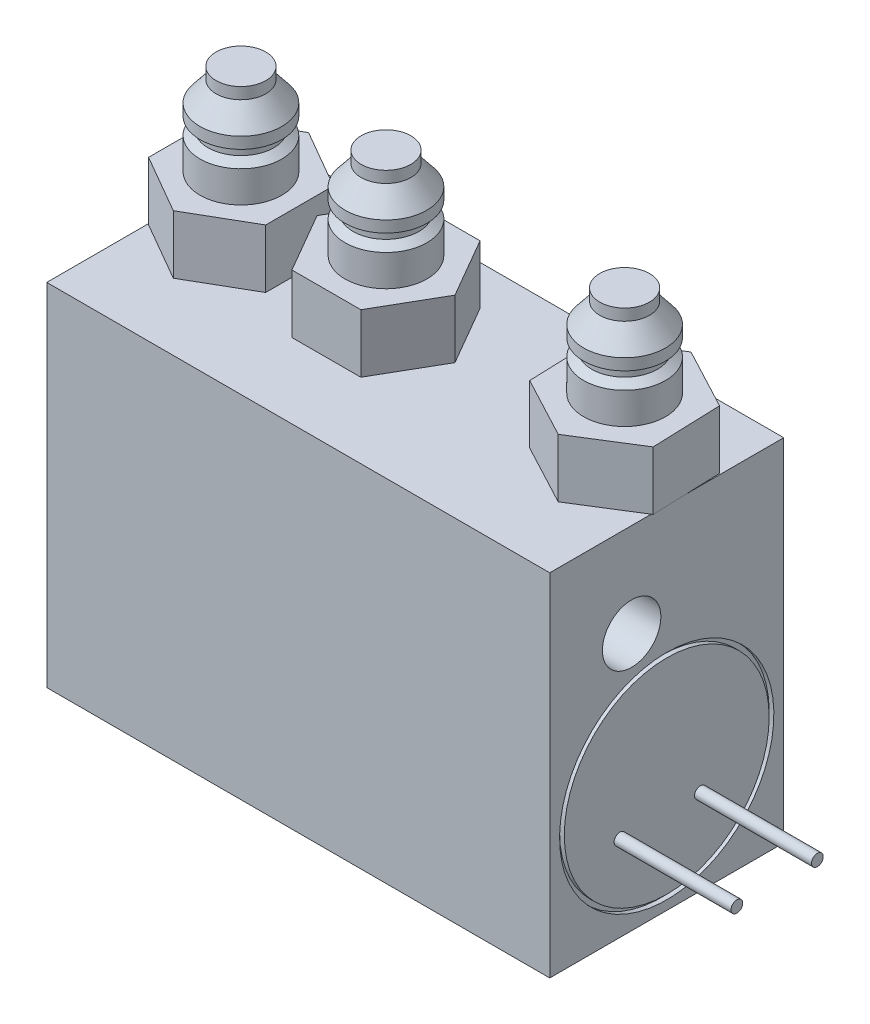
from build123d import *

# Parameters (mm, degrees)
ESQUISSE1_W               = 21.5
ESQUISSE1_H               = 15
EXTRUSION1_DEPTH          = 10
EXTRUSION2_DEPTH          = 2.5
ESQUISSE4_R               = 1.75
EXTRUSION3_DEPTH          = 3.9
ESQUISSE7_R               = 0.25
EXTRUSION4_DEPTH          = 5
ESQUISSE8_R               = 4.580355977
ESQUISSE8_R_2             = 4.37854461
ENL_V_MAT_EXTRU_3_DEPTH   = 0.2
TROU_TARAUD_M3X0_52_D     = 2.5
TROU_TARAUD_M3X0_52_DEPTH = 5.5
TROU_TARAUD_M3X0_52_TIP   = 0.751075774


with BuildPart() as part:
    # Esquisse1 → Extrusion1 (new body)
    with BuildSketch(Plane.XY):
        with Locations((-2.605785234, -7.251083667)):
            Rectangle(ESQUISSE1_W, ESQUISSE1_H)
    extrude(amount=EXTRUSION1_DEPTH)

    # Esquisse2 → Extrusion2 (add)
    with BuildSketch(Plane(origin=(0, 0.248916333, 0), x_dir=(-1, 0, 0), z_dir=(0, 1, 0))):
        Polygon((13.309313152, 5.695412518), (10.805785234, 7.140825036), (8.302257315, 5.695412518), (8.302257315, 2.804587482), (10.805785234, 1.359174964), (13.309313152, 2.804587482), align=None)
        Polygon((6.076207844, 6.801050244), (3.131722221, 6.798948457), (1.661299611, 4.247898212), (3.135362624, 1.698949756), (6.079848247, 1.701051543), (7.550270856, 4.252101788), align=None)
        Polygon((-3.097880639, 5.811510782), (-5.698355708, 7.192644162), (-8.194689836, 5.63113338), (-8.090548894, 2.688489218), (-5.490073824, 1.307355838), (-2.993739697, 2.86886662), align=None)
    extrude(amount=EXTRUSION2_DEPTH)

    # Esquisse4 → Extrusion3 (add)
    with BuildSketch(Plane(origin=(0, 2.748916333, 0), x_dir=(-1, 0, 0), z_dir=(0, 1, 0))):
        with Locations((10.805785234, 4.25)):
            Circle(ESQUISSE4_R)
        with Locations((4.605785234, 4.25)):
            Circle(ESQUISSE4_R)
        with Locations((-5.594214766, 4.25)):
            Circle(ESQUISSE4_R)
    extrude(amount=EXTRUSION3_DEPTH)

    # Esquisse7 → Extrusion4 (add)
    with BuildSketch(Plane(origin=(8.144214766, 0, 0), x_dir=(0, 0, -1), z_dir=(1, 0, 0))):
        with Locations((-3.56, -11.101083667)):
            Circle(ESQUISSE7_R)
        with Locations((-7, -11.101083667)):
            Circle(ESQUISSE7_R)
    extrude(amount=EXTRUSION4_DEPTH)

    # Esquisse8 → Enlèv. mat.-Extru.3 (cut)
    with BuildSketch(Plane(origin=(8.144214766, 0, 0), x_dir=(0, 0, -1), z_dir=(1, 0, 0))):
        with Locations((-5, -9.777233514)):
            Circle(ESQUISSE8_R)
        with Locations((-5, -9.777233514)):
            Circle(ESQUISSE8_R_2, mode=Mode.SUBTRACT)
    extrude(amount=-ENL_V_MAT_EXTRU_3_DEPTH, mode=Mode.SUBTRACT)

    # Trou taraudé M3x0.52
    with Locations(Plane(origin=(8.144214766, -3.751083667, 6.5), x_dir=(0, 1, 0), z_dir=(1, 0, 0))):
        with Locations((0, 0)):
            Hole(TROU_TARAUD_M3X0_52_D / 2, depth=TROU_TARAUD_M3X0_52_DEPTH)
            with Locations((0, 0, -(TROU_TARAUD_M3X0_52_DEPTH + TROU_TARAUD_M3X0_52_TIP / 2))):  # 118° drill point
                Cone(0, TROU_TARAUD_M3X0_52_D / 2, TROU_TARAUD_M3X0_52_TIP, mode=Mode.SUBTRACT)

    # Esquisse13 → Enlèvement de matière-Révolution1 (revolve, cut)
    with BuildSketch(Plane.XY.offset(4.25)):
        Polygon((-9.744077061, 6.648916333), (-9.744077061, 6.159304946), (-9.055785234, 5.295659421), (-9.055785234, 4.809098562), (-9.399931147, 4.809098562), (-9.399931147, 4.334701724), (-9.055785234, 4.091421295), (-9.055785234, 2.748916333), (-8.612823064, 2.748916333), (-8.612823064, 6.648916333), align=None)
    revolve(axis=Axis((-10.805785234, 6.648916333, 4.25), (0, -1, 0)), mode=Mode.SUBTRACT)

    # Esquisse14 → Enlèvement de matière-Révolution2 (revolve, cut)
    with BuildSketch(Plane.XY.offset(4.25)):
        Polygon((-3.544077061, 6.648916333), (-3.544077061, 6.159304946), (-2.855785234, 5.295659421), (-2.855785234, 4.809098562), (-3.199931147, 4.809098562), (-3.199931147, 4.334701724), (-2.855785234, 4.091421295), (-2.855785234, 2.748916333), (-2.412823064, 2.748916333), (-2.412823064, 6.648916333), align=None)
    revolve(axis=Axis((-4.605785234, 6.648916333, 4.25), (0, -1, 0)), mode=Mode.SUBTRACT)

    # Esquisse15 → Enlèvement de matière-Révolution3 (revolve, cut)
    with BuildSketch(Plane.XY.offset(4.25)):
        Polygon((6.655922939, 6.648916333), (6.655922939, 6.159304946), (7.344214766, 5.295659421), (7.344214766, 4.809098562), (7.000068853, 4.809098562), (7.000068853, 4.334701724), (7.344214766, 4.091421295), (7.344214766, 2.748916333), (7.787176936, 2.748916333), (7.787176936, 6.648916333), align=None)
    revolve(axis=Axis((5.594214766, 6.648916333, 4.25), (0, -1, 0)), mode=Mode.SUBTRACT)


solid = part.part
